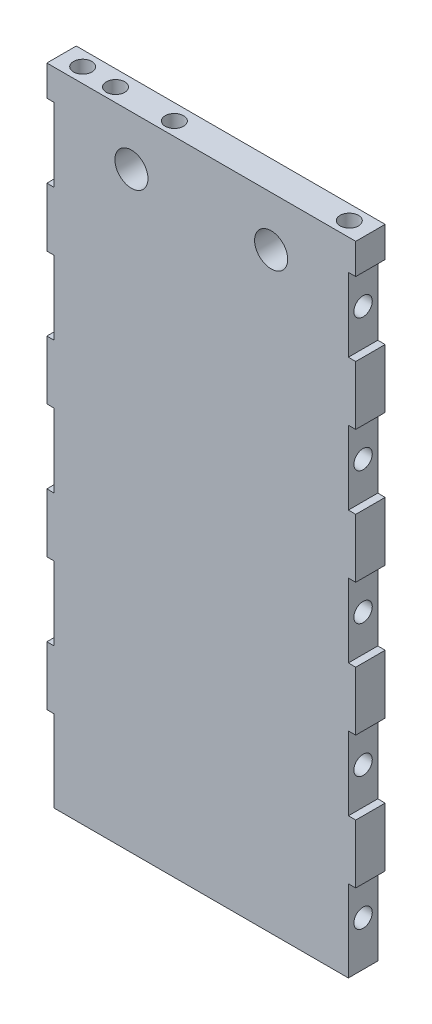
from build123d import *

# Parameters (mm, degrees)
SKETCH_1_W              = 84
SKETCH_1_H              = 176.5
EXTRUDE_1_DEPTH         = 4
CUT_EXTRUDE1_DEPTH      = 99.061524055
CUT_EXTRUDE1_DEPTH_BACK = 99.061524055
SKETCH2_W               = 2
SKETCH2_H               = 20
SKETCH2_H_2             = 22.2
SKETCH2_W_2             = 86
SKETCH2_H_3             = 2
SKETCH3_R               = 2.5
CUT_EXTRUDE2_DEPTH      = 10
SKETCH4_R               = 2
CUT_EXTRUDE3_DEPTH      = 8
SKETCH5_R               = 2.5
CUT_EXTRUDE4_DEPTH      = 10
SKETCH6_R               = 4.5
CUT_EXTRUDE5_DEPTH      = 99.061524055
SKETCH7_R               = 2.5
CUT_EXTRUDE6_DEPTH      = 10


with BuildPart() as part:
    # 草图1 → 凸台-拉伸1 (new, symmetric)
    with BuildSketch(Plane.XY):
        Rectangle(SKETCH_1_W, SKETCH_1_H)
    extrude(amount=EXTRUDE_1_DEPTH, both=True)

    # Sketch2 → Cut-Extrude1 (cut, two sides: drawn at the far end of the back side and taken through both)
    with BuildSketch(Plane.XY.offset(4).offset(-CUT_EXTRUDE1_DEPTH_BACK)):
        with Locations((-41, 67.95)):
            Rectangle(SKETCH2_W, SKETCH2_H)
        with Locations((-41, 31.95)):
            Rectangle(SKETCH2_W, SKETCH2_H)
        with Locations((-41, -4.05)):
            Rectangle(SKETCH2_W, SKETCH2_H)
        with Locations((-41, -40.05)):
            Rectangle(SKETCH2_W, SKETCH2_H)
        with Locations((-41, -77.15)):
            Rectangle(SKETCH2_W, SKETCH2_H_2)
        with Locations((41, -77.15)):
            Rectangle(SKETCH2_W, SKETCH2_H_2)
        with Locations((41, -40.05)):
            Rectangle(SKETCH2_W, SKETCH2_H)
        with Locations((41, -4.05)):
            Rectangle(SKETCH2_W, SKETCH2_H)
        with Locations((41, 31.95)):
            Rectangle(SKETCH2_W, SKETCH2_H)
        with Locations((41, 67.95)):
            Rectangle(SKETCH2_W, SKETCH2_H)
        with Locations((0, 87.25)):
            Rectangle(SKETCH2_W_2, SKETCH2_H_3)
    extrude(amount=CUT_EXTRUDE1_DEPTH + CUT_EXTRUDE1_DEPTH_BACK, mode=Mode.SUBTRACT)

    # Sketch3 → Cut-Extrude2 (cut)
    with BuildSketch(Plane(origin=(40, 0, 0), x_dir=(0, 0, -1), z_dir=(1, 0, 0))):
        with Locations((0, 67.95)):
            Circle(SKETCH3_R)
        with Locations((0, 31.95)):
            Circle(SKETCH3_R)
        with Locations((0, -4.05)):
            Circle(SKETCH3_R)
        with Locations((0, -40.05)):
            Circle(SKETCH3_R)
        with Locations((0, -76.05)):
            Circle(SKETCH3_R)
    cut_extrude2 = extrude(amount=-CUT_EXTRUDE2_DEPTH, mode=Mode.SUBTRACT)

    # Mirror1: Cut-Extrude2 across plane
    add(cut_extrude2.mirror(Plane(origin=(0, 0, 0), x_dir=(0, 0, 1), z_dir=(1, 0, 0))), mode=Mode.SUBTRACT)

    # Sketch4 → Cut-Extrude3 (cut)
    with BuildSketch(Plane.XZ.offset(88.25)):
        with Locations(Location((-34, 0, 0), (0, 0, 270))):
            Circle(SKETCH4_R)
        with Locations(Location((34, 0, 0), (0, 0, 90))):
            Circle(SKETCH4_R)
        with Locations(Location((0, 0, 0), (0, 0, 270))):
            Circle(SKETCH4_R)
    extrude(amount=-CUT_EXTRUDE3_DEPTH, mode=Mode.SUBTRACT)

    # Sketch5 → Cut-Extrude4 (cut)
    with BuildSketch(Plane(origin=(0, 86.25, 0), x_dir=(1, 0, 0), z_dir=(0, 1, 0))):
        with Locations(Location((-36.25, 0, 0), (0, 0, 270))):
            Circle(SKETCH5_R)
        with Locations(Location((36.25, 0, 0), (0, 0, 270))):
            Circle(SKETCH5_R)
    extrude(amount=-CUT_EXTRUDE4_DEPTH, mode=Mode.SUBTRACT)

    # Sketch6 → Cut-Extrude5 (cut, through all)
    with BuildSketch(Plane(origin=(0, 0, -4), x_dir=(-1, 0, 0), z_dir=(0, 0, -1))):
        with Locations((-19, 72.75)):
            Circle(SKETCH6_R)
        with Locations(Location((19, 72.75, 0), (0, 0, 180))):
            Circle(SKETCH6_R)
    extrude(amount=-CUT_EXTRUDE5_DEPTH, mode=Mode.SUBTRACT)

    # Sketch7 → Cut-Extrude6 (cut)
    with BuildSketch(Plane(origin=(0, 86.25, 0), x_dir=(1, 0, 0), z_dir=(0, 1, 0))):
        with Locations(Location((-11, -0.32, 0), (0, 0, 270))):
            Circle(SKETCH7_R)
        with Locations(Location((-27, -0.32, 0), (0, 0, 270))):
            Circle(SKETCH7_R)
    extrude(amount=-CUT_EXTRUDE6_DEPTH, mode=Mode.SUBTRACT)


solid = part.part
